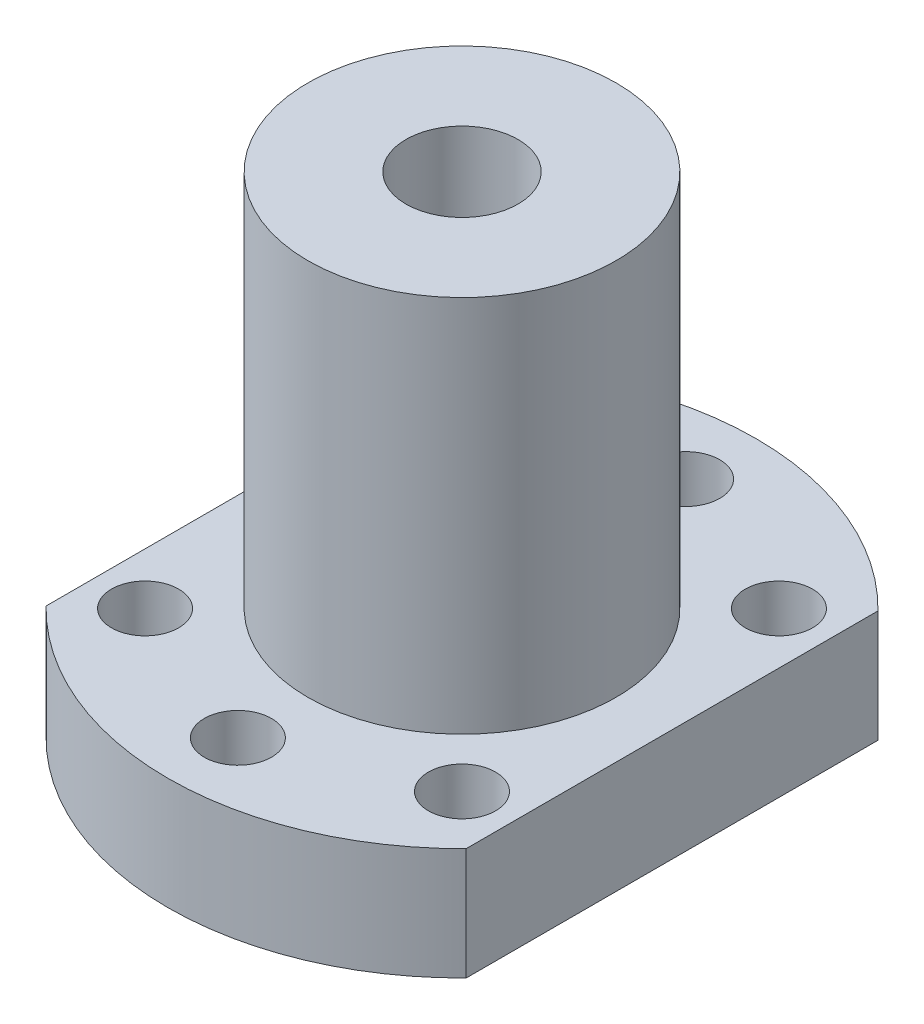
from build123d import *

# Parameters (mm, degrees)
EXTRUDE_1_DEPTH          = 8
SKETCH_2_R               = 4
CUT_EXTRUDE_1_DEPTH      = 28.018512172
SKETCH_3_R               = 2.4
CUT_EXTRUDE_2_DEPTH      = 8
PATTERN_CIRCULAR_2_COUNT = 8
SKETCH_4_R               = 11
EXTRUDE_2_DEPTH          = 27
SKETCH_5_R               = 4
CUT_EXTRUDE_3_DEPTH      = 44.48562981


with BuildPart() as part:
    # 草图1 → 凸台-拉伸1 (new body)
    with BuildSketch(Plane(origin=(0, 0, 0), x_dir=(1, 0, 0), z_dir=(0, 1, 0))):
        with BuildLine():
            Line((-15, 14.696938457), (-15, -14.696938457))
            ThreePointArc((-15, -14.696938457), (0, -21), (15, -14.696938457))
            Line((15, -14.696938457), (15, 14.696938457))
            ThreePointArc((15, 14.696938457), (0, 21), (-15, 14.696938457))
        make_face()
    extrude(amount=EXTRUDE_1_DEPTH)

    # 草图2 → 切除-拉伸1 (cut, through all)
    with BuildSketch(Plane(origin=(0, 8, 0), x_dir=(1, 0, 0), z_dir=(0, 1, 0))):
        with Locations(Location((0, 0, 0), (0, 0, 270))):
            Circle(SKETCH_2_R)
    extrude(amount=-CUT_EXTRUDE_1_DEPTH, mode=Mode.SUBTRACT)

    # 草图3 → 切除-拉伸2 (cut)
    with BuildSketch(Plane(origin=(0, 8, 0), x_dir=(1, 0, 0), z_dir=(0, 1, 0))):
        with Locations(Location((-11.313708499, 11.313708499, 0), (0, 0, 270))):
            Circle(SKETCH_3_R)
    cut_extrude_2 = extrude(amount=-CUT_EXTRUDE_2_DEPTH, mode=Mode.SUBTRACT)

    # 阵列(圆周)2: 切除-拉伸2 ×8 about axis, 2 skipped
    pattern_circular_2_axis = Axis((0, 8, 0), (0, 1, 0))
    add([cut_extrude_2.rotate(pattern_circular_2_axis, i * 360 / PATTERN_CIRCULAR_2_COUNT) for i in range(1, PATTERN_CIRCULAR_2_COUNT) if i not in (1, 5)], mode=Mode.SUBTRACT)

    # 草图4 → 凸台-拉伸2 (add)
    with BuildSketch(Plane(origin=(0, 8, 0), x_dir=(1, 0, 0), z_dir=(0, 1, 0))):
        with Locations(Location((0, 0, 0), (0, 0, 270))):
            Circle(SKETCH_4_R)
    extrude(amount=EXTRUDE_2_DEPTH)

    # 草图5 → 切除-拉伸3 (cut, through all)
    with BuildSketch(Plane(origin=(0, 35, 0), x_dir=(1, 0, 0), z_dir=(0, 1, 0))):
        with Locations(Location((0, 0, 0), (0, 0, 270))):
            Circle(SKETCH_5_R)
    extrude(amount=-CUT_EXTRUDE_3_DEPTH, mode=Mode.SUBTRACT)


solid = part.part
